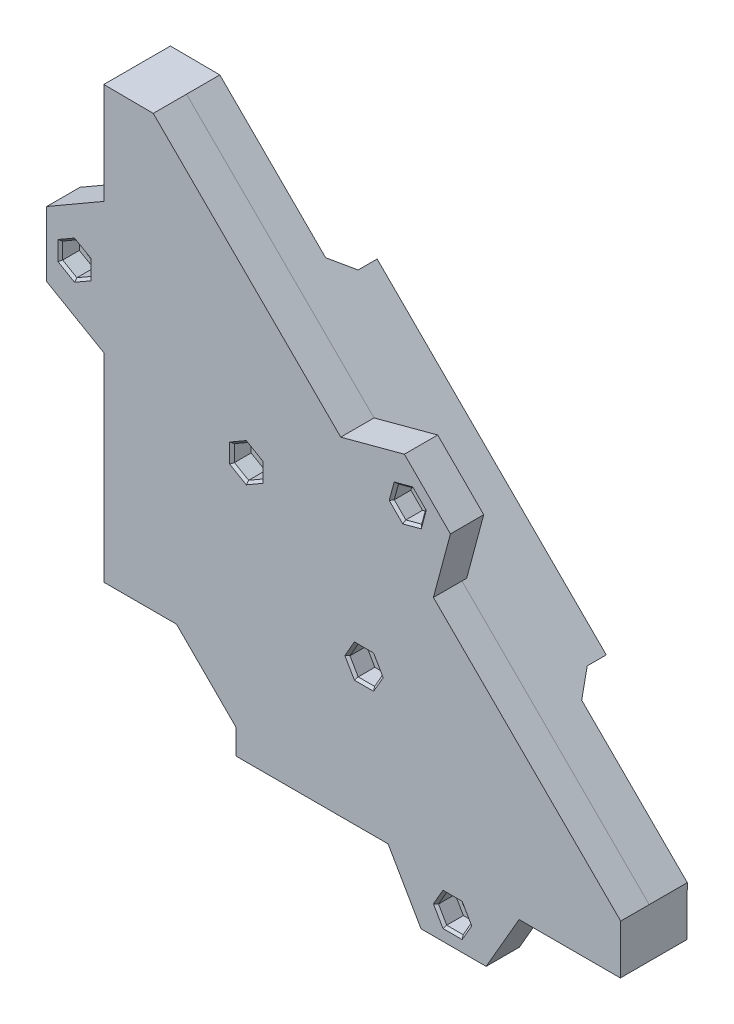
from build123d import *

# Parameters (mm, degrees)
BOSS_EXTRUDE1_DEPTH      = 7
SKETCH2_R                = 2.05
CUT_EXTRUDE1_DEPTH       = 210.034905978
CUT_EXTRUDE2_DEPTH       = 4
BOSS_EXTRUDE8_DEPTH      = 7
BOSS_EXTRUDE8_DEPTH_BACK = 1
BOSS_EXTRUDE9_DEPTH      = 8
SKETCH22_R               = 2
CUT_EXTRUDE3_DEPTH       = 211.072825271
CUT_EXTRUDE4_DEPTH       = 4
CHAMFER1_SIZE            = 0.5
CHAMFER2_SIZE            = 0.5
CHAMFER3_SIZE            = 4


with BuildPart() as part:
    # Sketch1 → Boss-Extrude1 (new body)
    with BuildSketch(Plane.XY):
        Polygon((-86.168640192, 66.168375393), (-46.796854981, 26.9381166), (-46.864915159, 16.542640687), (-68.155605804, 16.542640687), (-75.083809034, 4.542640687), (-88.767010414, 4.542640687), (-95.695213644, 16.542640687), (-127.7, 16.542640687), (-127.7, 21.829570993), (-140.170429007, 34.3), (-155.457359313, 34.3), (-155.457359313, 76.089816153), (-167.457359313, 83.018019384), (-167.457359313, 96.701220763), (-155.457359313, 103.629423994), (-155.457359313, 124.918472329), (-145.062341245, 124.850415149), (-105.649268389, 85.614252867), (-92.265224659, 89.200496576), (-82.589740175, 79.525012092), align=None)
    extrude(amount=-BOSS_EXTRUDE1_DEPTH)

    # Sketch2 → Cut-Extrude1 (cut, through all)
    with BuildSketch(Plane(origin=(0, 0, -7), x_dir=(-1, 0, 0), z_dir=(0, 0, -1))):
        with Locations((82.1403802, 10.392640687)):
            Circle(SKETCH2_R)
        with Locations((91.564057064, 80.226179394)):
            Circle(SKETCH2_R)
        with Locations((161.607359313, 89.8596198)):
            Circle(SKETCH2_R)
    extrude(amount=-CUT_EXTRUDE1_DEPTH, mode=Mode.SUBTRACT)

    # Sketch3 → Cut-Extrude2 (cut)
    with BuildSketch(Plane.XY):
        Polygon((-158.61957167, 88.1346198), (-158.61957167, 91.5846198), (-161.607359313, 93.3096198), (-164.595146956, 91.5846198), (-164.595146956, 88.1346198), (-161.607359313, 86.4096198), align=None)
        Polygon((-88.231612963, 81.1191051), (-90.671131358, 83.558623495), (-94.003575459, 82.665697789), (-94.896501165, 79.333253689), (-92.456982769, 76.893735294), (-89.124538669, 77.786660999), align=None)
        Polygon((-80.4153802, 7.404853044), (-78.6903802, 10.392640687), (-80.4153802, 13.38042833), (-83.8653802, 13.38042833), (-85.5903802, 10.392640687), (-83.8653802, 7.404853044), align=None)
    extrude(amount=-CUT_EXTRUDE2_DEPTH, mode=Mode.SUBTRACT)

    # Sketch19 → Boss-Extrude8 (add, two sides: drawn at the far end of the back side and taken through both)
    with BuildSketch(Plane(origin=(0, 0, -7), x_dir=(-1, 0, 0), z_dir=(0, 0, -1)).offset(-BOSS_EXTRUDE8_DEPTH_BACK)):
        Polygon((46.864915159, 16.542640687), (46.796854981, 26.9381166), (145.062341245, 124.850415149), (155.457359313, 124.918472329), (155.457359313, 34.3), (140.170429007, 34.3), (127.7, 21.829570993), (127.7, 16.542640687), align=None)
    extrude(amount=BOSS_EXTRUDE8_DEPTH + BOSS_EXTRUDE8_DEPTH_BACK)

    # Sketch20 → Boss-Extrude9 (add)
    with BuildSketch(Plane(origin=(0, 0, -14), x_dir=(-1, 0, 0), z_dir=(0, 0, -1))):
        Polygon((127.7, 16.542640687), (107.164334943, 16.542640687), (71.827840432, 51.879135198), (119.997668017, 99.875829855), (155.457359313, 64.416138559), (155.457359313, 34.3), (140.170429007, 34.3), (127.7, 21.829570993), align=None)
    extrude(amount=BOSS_EXTRUDE9_DEPTH)

    # Sketch22 → Cut-Extrude3 (cut, through all)
    with BuildSketch(Plane(origin=(0, 0, -22), x_dir=(-1, 0, 0), z_dir=(0, 0, -1))):
        with Locations((100.752632712, 46.288866697)):
            Circle(SKETCH22_R)
        with Locations((125.501370054, 71.037604039)):
            Circle(SKETCH22_R)
    extrude(amount=-CUT_EXTRUDE3_DEPTH, mode=Mode.SUBTRACT)

    # Sketch23 → Cut-Extrude4 (cut)
    with BuildSketch(Plane.XY):
        Polygon((-125.501370054, 74.487604039), (-128.489157697, 72.762604039), (-128.489157697, 69.312604039), (-125.501370054, 67.587604039), (-122.513582411, 69.312604039), (-122.513582411, 72.762604039), align=None)
        Polygon((-104.202632712, 46.288866697), (-102.477632712, 43.301079054), (-99.027632712, 43.301079054), (-97.302632712, 46.288866697), (-99.027632712, 49.27665434), (-102.477632712, 49.27665434), align=None)
    extrude(amount=-CUT_EXTRUDE4_DEPTH, mode=Mode.SUBTRACT)

    # Chamfer1
    chamfer1_edges = [part.edges().sort_by_distance(p)[0] for p in [
        (-160.113465491, 87.2721198, 0),
        (-158.61957167, 89.8596198, 0),
        (-160.113465491, 92.4471198, 0),
        (-163.101253134, 92.4471198, 0),
        (-164.595146956, 89.8596198, 0),
        (-163.101253134, 87.2721198, 0),
        (-88.678075816, 79.45288305, 0),
        (-89.451372161, 82.338864297, 0),
        (-92.337353409, 83.112160642, 0),
        (-94.450038312, 80.999475739, 0),
        (-93.676741967, 78.113494491, 0),
        (-90.790760719, 77.340198146, 0),
        (-82.1403802, 7.404853044, 0),
        (-79.5528802, 8.898746866, 0),
        (-79.5528802, 11.886534509, 0),
        (-82.1403802, 13.38042833, 0),
        (-84.7278802, 11.886534509, 0),
        (-84.7278802, 8.898746866, 0),
    ]]
    chamfer(chamfer1_edges, length=CHAMFER1_SIZE)

    # Chamfer2
    chamfer2_edges = [part.edges().sort_by_distance(p)[0] for p in [
        (-124.007476232, 73.625104039, 0),
        (-126.995263875, 73.625104039, 0),
        (-128.489157697, 71.037604039, 0),
        (-126.995263875, 68.450104039, 0),
        (-124.007476232, 68.450104039, 0),
        (-122.513582411, 71.037604039, 0),
        (-103.340132712, 47.782760519, 0),
        (-103.340132712, 44.794972876, 0),
        (-100.752632712, 43.301079054, 0),
        (-98.165132712, 44.794972876, 0),
        (-98.165132712, 47.782760519, 0),
        (-100.752632712, 49.27665434, 0),
    ]]
    chamfer(chamfer2_edges, length=CHAMFER2_SIZE)

    # Chamfer3
    chamfer3_edges = [part.edges().sort_by_distance(p)[0] for p in [
        (-137.727513665, 82.145984207, -14),
        (-89.496087688, 34.210887943, -14),
    ]]
    chamfer(chamfer3_edges, length=CHAMFER3_SIZE)


solid = part.part
